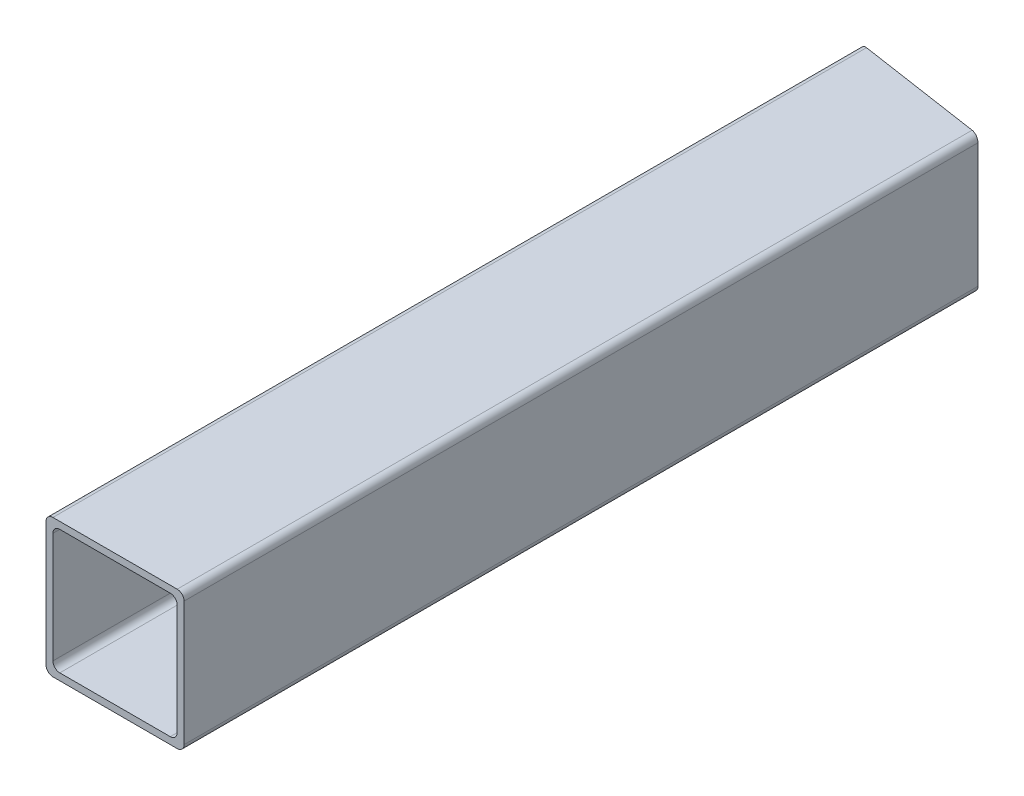
from build123d import *

# Parameters (mm, degrees)
EXTRUDE_1_DEPTH     = 236
CUT_EXTRUDE_1_DEPTH = 241.199916736


with BuildPart() as part:
    # Эскиз1 → Бобышка-Вытянуть1 (new body)
    with BuildSketch(Plane.XY):
        with BuildLine():
            Line((-18, 20), (18, 20))
            ThreePointArc((18, 20), (19.414213562, 19.414213562), (20, 18))
            Line((20, 18), (20, -18))
            ThreePointArc((20, -18), (19.414213562, -19.414213562), (18, -20))
            Line((18, -20), (-18, -20))
            ThreePointArc((-18, -20), (-19.414213562, -19.414213562), (-20, -18))
            Line((-20, -18), (-20, 18))
            ThreePointArc((-20, 18), (-19.414213562, 19.414213562), (-18, 20))
        make_face()
        with BuildLine():
            Line((-16, 18), (16, 18))
            ThreePointArc((16, 18), (17.414213562, 17.414213562), (18, 16))
            Line((18, 16), (18, -16))
            ThreePointArc((18, -16), (17.414213562, -17.414213562), (16, -18))
            Line((16, -18), (-16, -18))
            ThreePointArc((-16, -18), (-17.414213562, -17.414213562), (-18, -16))
            Line((-18, -16), (-18, 16))
            ThreePointArc((-18, 16), (-17.414213562, 17.414213562), (-16, 18))
        make_face(mode=Mode.SUBTRACT)
    extrude(amount=EXTRUDE_1_DEPTH)

    # Эскиз2 → Вырез-Вытянуть1 (cut, through all)
    with BuildSketch(Plane(origin=(0, 20, 0), x_dir=(1, 0, 0), z_dir=(0, 1, 0))):
        Polygon((20, -6), (-20, 0), (20, 0), align=None)
    extrude(amount=-CUT_EXTRUDE_1_DEPTH, mode=Mode.SUBTRACT)


solid = part.part
